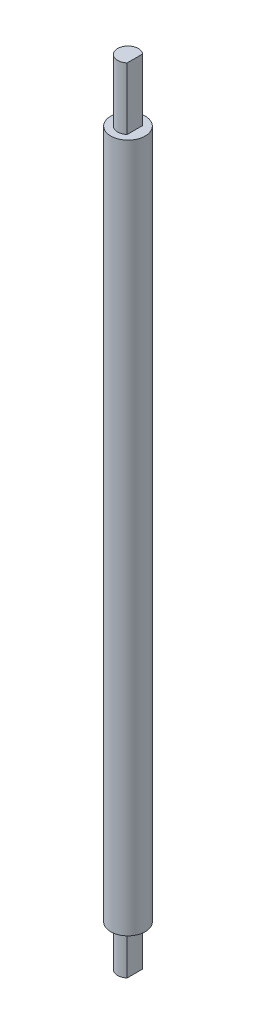
from build123d import *

# Parameters (mm, degrees)
SKETCH_1_R      = 2.5
EXTRUDE_1_DEPTH = 100
EXTRUDE_2_DEPTH = 9
EXTRUDE_START   = 6
EXTRUDE_3_DEPTH = 6


with BuildPart() as part:
    # 草图1 → 凸台-拉伸1 (new body)
    with BuildSketch(Plane(origin=(0, 0, 0), x_dir=(1, 0, 0), z_dir=(0, 1, 0))):
        with Locations(Location((0, 0, 0), (0, 0, 270))):
            Circle(SKETCH_1_R)
    extrude(amount=EXTRUDE_1_DEPTH)

    # 草图2 → 凸台-拉伸2 (add)
    with BuildSketch(Plane(origin=(0, 100, 0), x_dir=(1, 0, 0), z_dir=(0, 1, 0))):
        with BuildLine():
            Line((1, 1.118033989), (1, -1.118033989))
            ThreePointArc((1, -1.118033989), (-1.5, 0), (1, 1.118033989))
        make_face()
    extrude(amount=EXTRUDE_2_DEPTH)

    # 草图3 → 凸台-拉伸3 (add)
    with BuildSketch(Plane.XZ.offset(EXTRUDE_START)):
        with BuildLine():
            Line((1, -1.118033989), (1, 1.118033989))
            ThreePointArc((1, 1.118033989), (-1.5, 0), (1, -1.118033989))
        make_face()
    extrude(amount=-EXTRUDE_3_DEPTH)


solid = part.part
